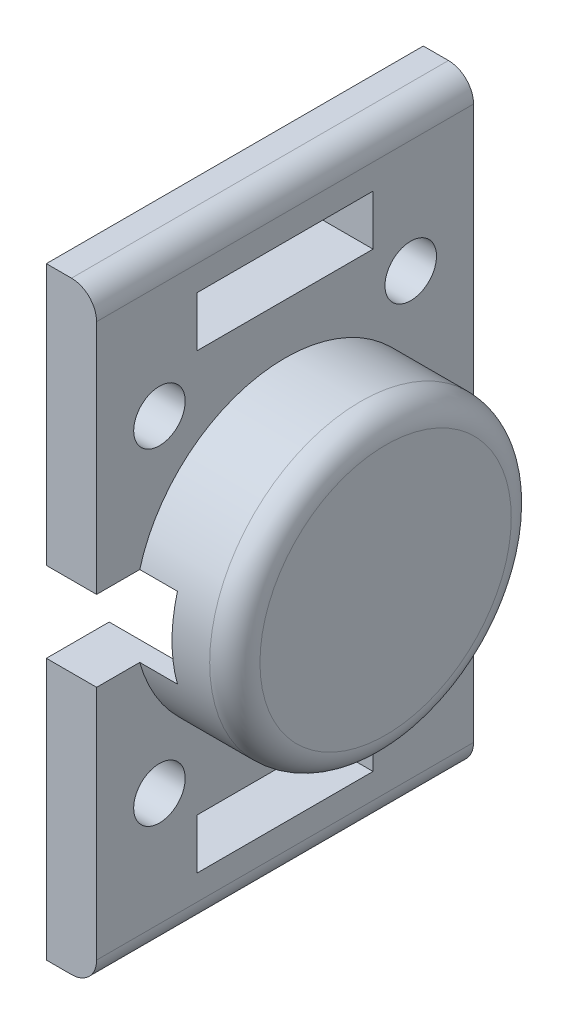
from build123d import *

# Parameters (mm, degrees)
SKETCH1_W                    = 15
SKETCH1_H                    = 24
BOSS_EXTRUDE1_DEPTH          = 6
SKETCH2_R                    = 5.25
CUT_EXTRUDE1_DEPTH           = 3.5
CUT_EXTRUDE2_REACH           = 24.136
CUT_EXTRUDE2_END_RADIUS      = 5.25
SKETCH3_W                    = 3.5
SKETCH3_H                    = 3.2
SKETCH4_W                    = 7
SKETCH4_H                    = 2
CUT_EXTRUDE3_DEPTH           = 10
SKETCH5_R                    = 0.8
CUT_EXTRUDE4_DEPTH           = 1.2
SKETCH6_OUTSIDE_W            = 22.786
SKETCH6_OUTSIDE_H            = 31.786
SKETCH6_OUTSIDE_R            = 6
CUT_EXTRUDE5_DEPTH           = 4
M2_5X0_45_TAPPED_HOLE1_D     = 2.05
M2_5X0_45_TAPPED_HOLE1_DEPTH = 6.35
M2_5X0_45_TAPPED_HOLE1_TIP   = 0.615882135
FILLET1_R                    = 1


with BuildPart() as part:
    # Sketch1 → Boss-Extrude1 (new body)
    with BuildSketch(Plane(origin=(0, 0, -7.5), x_dir=(0, 0, 1), z_dir=(-1, 0, 0))):
        Rectangle(SKETCH1_W, SKETCH1_H)
    extrude(amount=BOSS_EXTRUDE1_DEPTH)

    # Sketch2 → Cut-Extrude1 (cut)
    with BuildSketch(Plane.ZY.offset(6)):
        with Locations((-7.5, 0)):
            Circle(SKETCH2_R)
    extrude(amount=-CUT_EXTRUDE1_DEPTH, mode=Mode.SUBTRACT)

    # Cut-Extrude2: up to this cylinder (the profile starts outside it)
    cut_extrude2_end = Plane(origin=(-4.25, 0, -7.5), z_dir=(-1, 0, 0)) * Cylinder(CUT_EXTRUDE2_END_RADIUS, 59.772, mode=Mode.PRIVATE)
    # Sketch3 → Cut-Extrude2 (cut, up to the surface)
    with BuildSketch(Plane(origin=(5, 0, 0), x_dir=(1, 0, 0), z_dir=(0, 0, 1)), mode=Mode.PRIVATE) as cut_extrude2_sk1:
        with Locations((-9.25, 0)):
            Rectangle(SKETCH3_W, SKETCH3_H)
    cut_extrude2_tool1 = extrude(cut_extrude2_sk1.sketch, amount=-CUT_EXTRUDE2_REACH, mode=Mode.PRIVATE) - cut_extrude2_end
    add(cut_extrude2_tool1.solids().sort_by_distance((-4.25, 0, 0))[0], mode=Mode.SUBTRACT)

    # Sketch4 → Cut-Extrude3 (cut)
    with BuildSketch(Plane(origin=(0, 0, 0), x_dir=(0, 0, -1), z_dir=(1, 0, 0))):
        with Locations((7.5, 9)):
            Rectangle(SKETCH4_W, SKETCH4_H)
        with Locations((7.5, -9)):
            Rectangle(SKETCH4_W, SKETCH4_H)
    extrude(amount=-CUT_EXTRUDE3_DEPTH, mode=Mode.SUBTRACT)

    # Sketch5 → Cut-Extrude4 (cut)
    with BuildSketch(Plane.ZY.offset(2.5)):
        with Locations((-7.5, 0)):
            Circle(SKETCH5_R)
    extrude(amount=-CUT_EXTRUDE4_DEPTH, mode=Mode.SUBTRACT)

    # Sketch6 outside → Cut-Extrude5 (cut)
    with BuildSketch(Plane(origin=(0, 0, 0), x_dir=(0, 0, -1), z_dir=(1, 0, 0))):
        with Locations((7.5, 0)):
            Rectangle(SKETCH6_OUTSIDE_W, SKETCH6_OUTSIDE_H)
        with Locations((7.5, 0)):
            Circle(SKETCH6_OUTSIDE_R, mode=Mode.SUBTRACT)
    extrude(amount=-CUT_EXTRUDE5_DEPTH, mode=Mode.SUBTRACT)

    # M2.5x0.45 Tapped Hole1
    with Locations(Plane.ZY.offset(6)):
        with Locations((-12.5, 6.5), (-2.5, 6.5), (-2.5, -6.5), (-12.5, -6.5)):
            Hole(M2_5X0_45_TAPPED_HOLE1_D / 2, depth=M2_5X0_45_TAPPED_HOLE1_DEPTH)
            with Locations((0, 0, -(M2_5X0_45_TAPPED_HOLE1_DEPTH + M2_5X0_45_TAPPED_HOLE1_TIP / 2))):  # 118° drill point
                Cone(0, M2_5X0_45_TAPPED_HOLE1_D / 2, M2_5X0_45_TAPPED_HOLE1_TIP, mode=Mode.SUBTRACT)

    # Fillet1
    fillet1_edges = [part.edges().sort_by_distance(p)[0] for p in [
        (0, 0, -1.5),
        (-4, -12, -7.5),
        (-4, 12, -7.5),
    ]]
    fillet(fillet1_edges, radius=FILLET1_R)


solid = part.part
